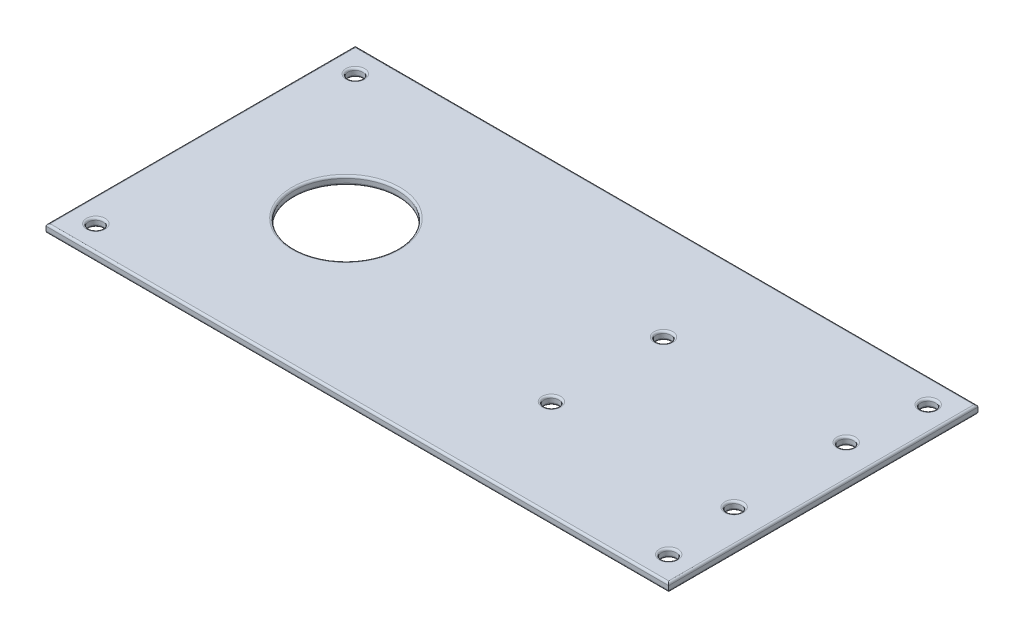
from build123d import *

# Parameters (mm, degrees)
SKETCH1_W           = 150
SKETCH1_H           = 74.5
SKETCH1_R           = 1.75
SKETCH1_R_2         = 12.5
BOSS_EXTRUDE1_DEPTH = 2
FILLET1_R           = 0.5


with BuildPart() as part:
    # Sketch1 → Boss-Extrude1 (new body)
    with BuildSketch(Plane(origin=(0, 0, 0), x_dir=(1, 0, 0), z_dir=(0, 1, 0))):
        with Locations((75, 37.25)):
            Rectangle(SKETCH1_W, SKETCH1_H)
        with Locations(Location((144, 6, 0), (0, 0, 270))):
            Circle(SKETCH1_R, mode=Mode.SUBTRACT)
        with Locations(Location((144, 68.5, 0), (0, 0, 270))):
            Circle(SKETCH1_R, mode=Mode.SUBTRACT)
        with Locations(Location((35, 37.25, 0), (0, 0, 270))):
            Circle(SKETCH1_R_2, mode=Mode.SUBTRACT)
        with Locations(Location((6, 68.5, 0), (0, 0, 270))):
            Circle(SKETCH1_R, mode=Mode.SUBTRACT)
        with Locations(Location((6, 6, 0), (0, 0, 270))):
            Circle(SKETCH1_R, mode=Mode.SUBTRACT)
        with Locations(Location((98, 50.75, 0), (0, 0, 270))):
            Circle(SKETCH1_R, mode=Mode.SUBTRACT)
        with Locations(Location((142, 50.75, 0), (0, 0, 270))):
            Circle(SKETCH1_R, mode=Mode.SUBTRACT)
        with Locations(Location((142, 23.75, 0), (0, 0, 270))):
            Circle(SKETCH1_R, mode=Mode.SUBTRACT)
        with Locations(Location((98, 23.75, 0), (0, 0, 270))):
            Circle(SKETCH1_R, mode=Mode.SUBTRACT)
    extrude(amount=BOSS_EXTRUDE1_DEPTH)

    # Fillet1
    fillet1_edges = [part.edges().sort_by_distance(p)[0] for p in [
        (144, 0, -7.75),
        (144, 2, -7.75),
        (150, 2, -37.25),
        (144, 0, -70.25),
        (144, 2, -70.25),
        (75, 2, -74.5),
        (35, 0, -49.75),
        (35, 2, -49.75),
        (6, 0, -70.25),
        (6, 2, -70.25),
        (6, 0, -7.75),
        (6, 2, -7.75),
        (98, 0, -52.5),
        (98, 2, -52.5),
        (142, 0, -52.5),
        (142, 2, -52.5),
        (142, 0, -25.5),
        (142, 2, -25.5),
        (98, 0, -25.5),
        (98, 2, -25.5),
        (0, 2, -37.25),
        (75, 0, -74.5),
        (150, 0, -37.25),
        (75, 0, 0),
        (0, 0, -37.25),
        (75, 2, 0),
    ]]
    fillet(fillet1_edges, radius=FILLET1_R)


solid = part.part
